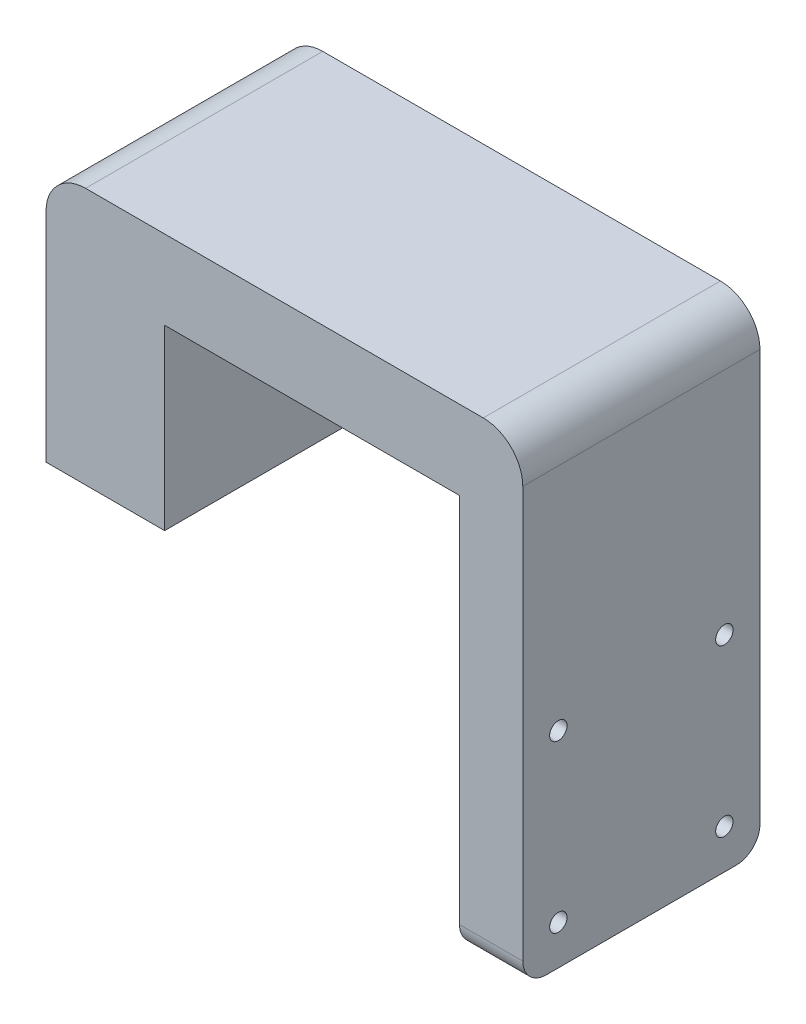
from build123d import *

# Parameters (mm, degrees)
EXTRUDE_1_DEPTH     = 30
SKETCH_2_R          = 1.1
CUT_EXTRUDE_1_DEPTH = 69.494817322
FILLET_1_R          = 3
SKETCH_3_R          = 3.25
CUT_EXTRUDE_2_DEPTH = 5


with BuildPart() as part:
    # ｽｹｯﾁ1 → ﾎﾞｽ - 押し出し1 (new body)
    with BuildSketch(Plane.XY):
        with BuildLine():
            ThreePointArc((-15, 27.5), (-13.535533906, 31.035533906), (-10, 32.5))
            Line((-10, 32.5), (40.3, 32.5))
            ThreePointArc((40.3, 32.5), (43.835533906, 31.035533906), (45.3, 27.5))
            Line((45.3, 27.5), (45.3, -27.5))
            Line((45.3, -27.5), (37.3, -27.5))
            Line((37.3, -27.5), (37.3, 22.5))
            Line((37.3, 22.5), (0, 22.5))
            Line((0, 22.5), (0, 0))
            Line((0, 0), (-15, 0))
            Line((-15, 0), (-15, 27.5))
        make_face()
    extrude(amount=EXTRUDE_1_DEPTH)

    # ｽｹｯﾁ2 → ｶｯﾄ - 押し出し1 (cut, through all)
    with BuildSketch(Plane.ZY.offset(-37.3)):
        with Locations(Location((4.5, -22.5, 0), (0, 0, 270))):
            Circle(SKETCH_2_R)
        with Locations(Location((25.5, -22.5, 0), (0, 0, 270))):
            Circle(SKETCH_2_R)
        with Locations(Location((4.5, -1.5, 0), (0, 0, 270))):
            Circle(SKETCH_2_R)
        with Locations(Location((25.5, -1.5, 0), (0, 0, 270))):
            Circle(SKETCH_2_R)
    extrude(amount=-CUT_EXTRUDE_1_DEPTH, mode=Mode.SUBTRACT)

    # ﾌｨﾚｯﾄ1
    fillet_1_edges = [part.edges().sort_by_distance(p)[0] for p in [
        (41.3, -27.5, 0),
        (41.3, -27.5, 30),
    ]]
    fillet(fillet_1_edges, radius=FILLET_1_R)

    # ｽｹｯﾁ3 → ｶｯﾄ - 押し出し2 (cut)
    with BuildSketch(Plane.ZY.offset(-37.3)):
        with Locations(Location((4.5, -22.5, 0), (0, 0, 270))):
            Circle(SKETCH_3_R)
        with Locations(Location((25.5, -22.5, 0), (0, 0, 270))):
            Circle(SKETCH_3_R)
        with Locations(Location((4.5, -1.5, 0), (0, 0, 270))):
            Circle(SKETCH_3_R)
        with Locations(Location((25.5, -1.5, 0), (0, 0, 270))):
            Circle(SKETCH_3_R)
    extrude(amount=-CUT_EXTRUDE_2_DEPTH, mode=Mode.SUBTRACT)


solid = part.part
